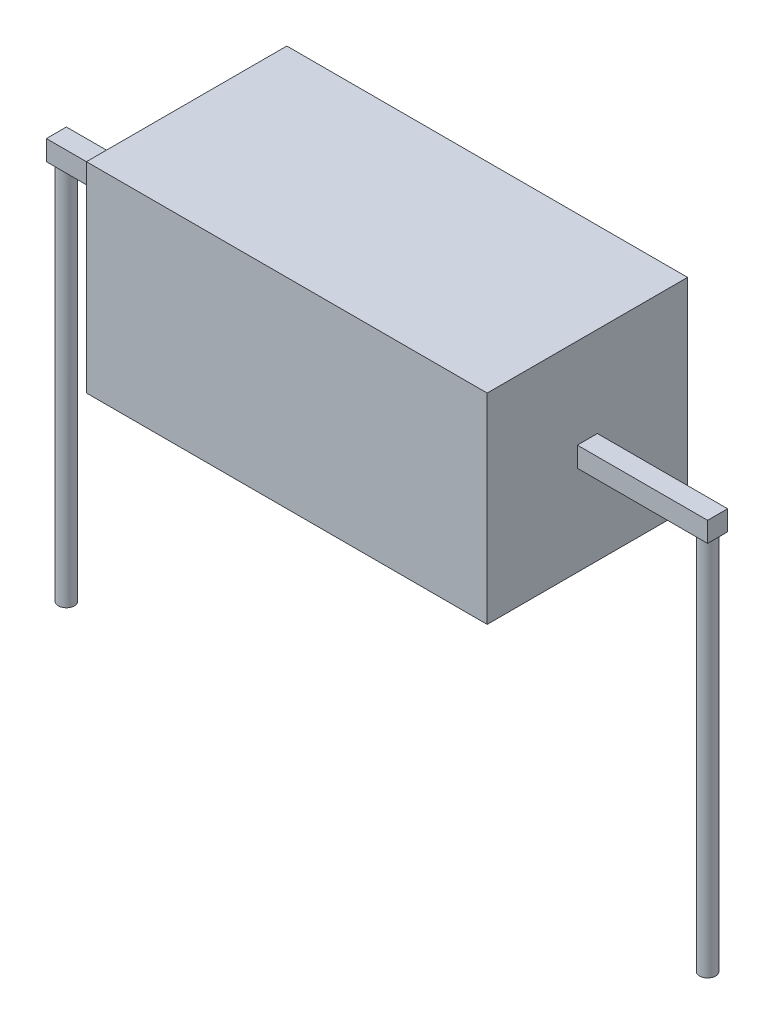
from build123d import *

# Parameters (mm, degrees)
SKETCH_1_W           = 20
SKETCH_1_H           = 10
EXTRUDE_1_DEPTH      = 10
EXTRUDE_2_DEPTH      = 6.5
EXTRUDE_2_DEPTH_BACK = 26.5
SKETCH_2_W           = 1
SKETCH_2_H           = 1
SKETCH_3_R           = 0.4
EXTRUDE_3_DEPTH      = 19


with BuildPart() as part:
    # Эскиз1 → Вытянуть1 (new body)
    with BuildSketch(Plane.XY):
        with Locations((10, 5)):
            Rectangle(SKETCH_1_W, SKETCH_1_H)
    extrude(amount=EXTRUDE_1_DEPTH)

    # Эскиз2 → Вытянуть2 (add, two sides: drawn at the far end of the back side and taken through both)
    with BuildSketch(Plane(origin=(20, 0, 0), x_dir=(0, 0, -1), z_dir=(1, 0, 0)).offset(-EXTRUDE_2_DEPTH_BACK)):
        with Locations((-5, 5)):
            Rectangle(SKETCH_2_W, SKETCH_2_H)
    extrude(amount=EXTRUDE_2_DEPTH + EXTRUDE_2_DEPTH_BACK)

    # Эскиз3 → Вытянуть3 (add)
    with BuildSketch(Plane.XZ.offset(-4.5)):
        with Locations(Location((-6, 5, 0), (0, 0, 90))):
            Circle(SKETCH_3_R)
        with Locations(Location((26, 5, 0), (0, 0, 90))):
            Circle(SKETCH_3_R)
    extrude(amount=EXTRUDE_3_DEPTH)


solid = part.part
